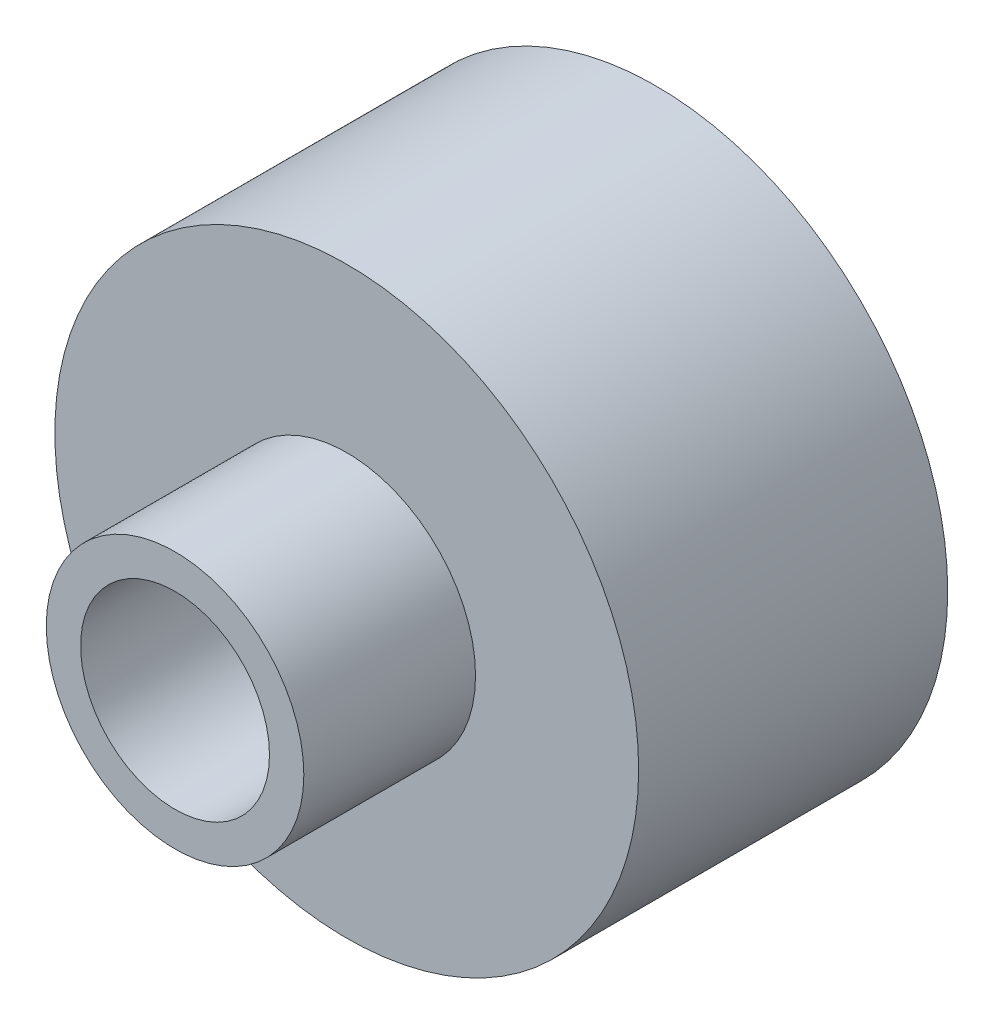
from build123d import *


with BuildPart() as part:
    # Эскиз1 → Повернуть1 (revolve)
    with BuildSketch(Plane(origin=(0, 0, 0), x_dir=(1, 0, 0), z_dir=(0, 1, 0))):
        Polygon((2.75, -14), (3.75, -14), (3.75, -9), (8.5, -9), (8.5, 0), (2.75, 0), align=None)
    revolve(axis=Axis((0, 0, 0), (0, 0, 1)))


solid = part.part
